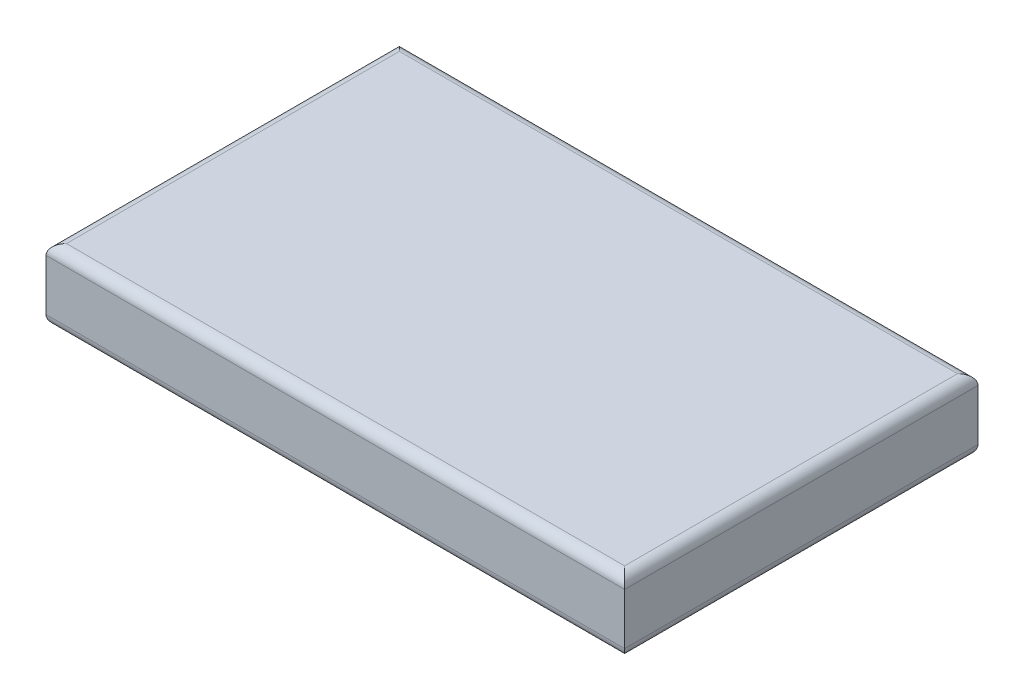
from build123d import *

# Parameters (mm, degrees)
SKETCH_1_W      = 56.5
SKETCH_1_H      = 34.5
EXTRUDE_1_DEPTH = 7
FILLET_1_R      = 1


with BuildPart() as part:
    # 草圖1 → 填料-伸長1 (new body)
    with BuildSketch(Plane(origin=(0, 0, 0), x_dir=(1, 0, 0), z_dir=(0, 1, 0))):
        with Locations((28.25, 17.25)):
            Rectangle(SKETCH_1_W, SKETCH_1_H)
    extrude(amount=EXTRUDE_1_DEPTH)

    # 圓角1
    fillet_1_edges = [part.edges().sort_by_distance(p)[0] for p in [
        (56.5, 7, -17.25),
        (28.25, 7, -34.5),
        (0, 7, -17.25),
        (28.25, 0, -34.5),
        (56.5, 0, -17.25),
        (28.25, 0, 0),
        (0, 0, -17.25),
        (28.25, 7, 0),
    ]]
    fillet(fillet_1_edges, radius=FILLET_1_R)


solid = part.part
